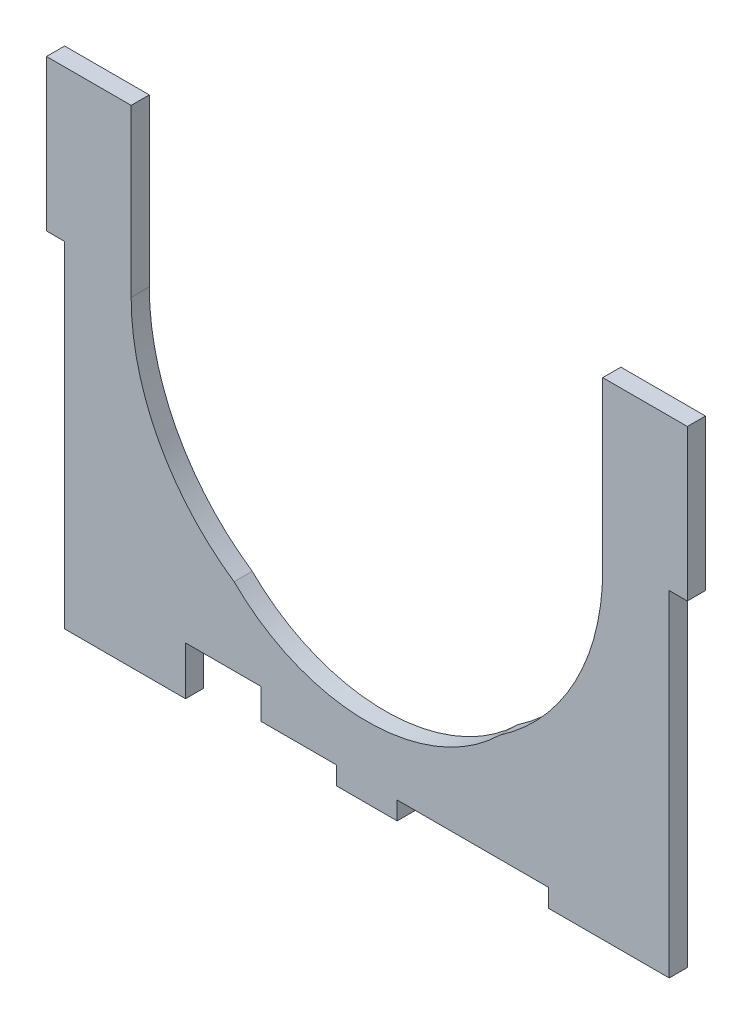
from build123d import *

# Parameters (mm, degrees)
BOSS_EXTRUDE1_DEPTH = 6
SKETCH3_W           = 6
SKETCH3_H           = 50
BOSS_EXTRUDE2_DEPTH = 6
LPATTERN1_COUNT     = 2
LPATTERN1_PITCH     = 206
SKETCH4_W           = 40
SKETCH4_H           = 6
SKETCH4_W_2         = 20
BOSS_EXTRUDE3_DEPTH = 6
SKETCH5_W           = 25
SKETCH5_H           = 10
CUT_EXTRUDE1_DEPTH  = 10


with BuildPart() as part:
    # Sketch1 → Boss-Extrude1 (new body)
    with BuildSketch(Plane.XY):
        with BuildLine():
            Line((-178, 100), (-178, 155))
            Line((-178, 155), (-200, 155))
            Line((-200, 155), (-200, 0))
            Line((-200, 0), (0, 0))
            Line((0, 0), (0, 155))
            Line((0, 155), (-22, 155))
            Line((-22, 155), (-22, 100))
            ThreePointArc((-22, 100), (-31.037807258, 63.555302549), (-56.056819802, 35.55625))
            ThreePointArc((-56.056819802, 35.55625), (-100, 17.5), (-143.943180198, 35.55625))
            ThreePointArc((-143.943180198, 35.55625), (-168.962192742, 63.555302549), (-178, 100))
        make_face()
    extrude(amount=BOSS_EXTRUDE1_DEPTH)

    # Sketch3 → Boss-Extrude2 (add)
    with BuildSketch(Plane.XY.offset(6)):
        with Locations((-203, 130)):
            Rectangle(SKETCH3_W, SKETCH3_H)
    boss_extrude2 = extrude(amount=-BOSS_EXTRUDE2_DEPTH)

    # LPattern1: Boss-Extrude2 ×2
    with Locations(*[(i * LPATTERN1_PITCH, 0, 0) for i in range(1, LPATTERN1_COUNT)]):
        add(boss_extrude2)

    # Sketch4 → Boss-Extrude3 (add)
    with BuildSketch(Plane.XY.offset(6)):
        with Locations((-180, -3)):
            Rectangle(SKETCH4_W, SKETCH4_H)
        with Locations((-100, -3)):
            Rectangle(SKETCH4_W_2, SKETCH4_H)
        with Locations((-20, -3)):
            Rectangle(SKETCH4_W, SKETCH4_H)
    extrude(amount=-BOSS_EXTRUDE3_DEPTH)

    # Sketch5 → Cut-Extrude1 (cut)
    with BuildSketch(Plane.XY.offset(6)):
        with Locations((-147.5, 5)):
            Rectangle(SKETCH5_W, SKETCH5_H)
    extrude(amount=-CUT_EXTRUDE1_DEPTH, mode=Mode.SUBTRACT)


solid = part.part
